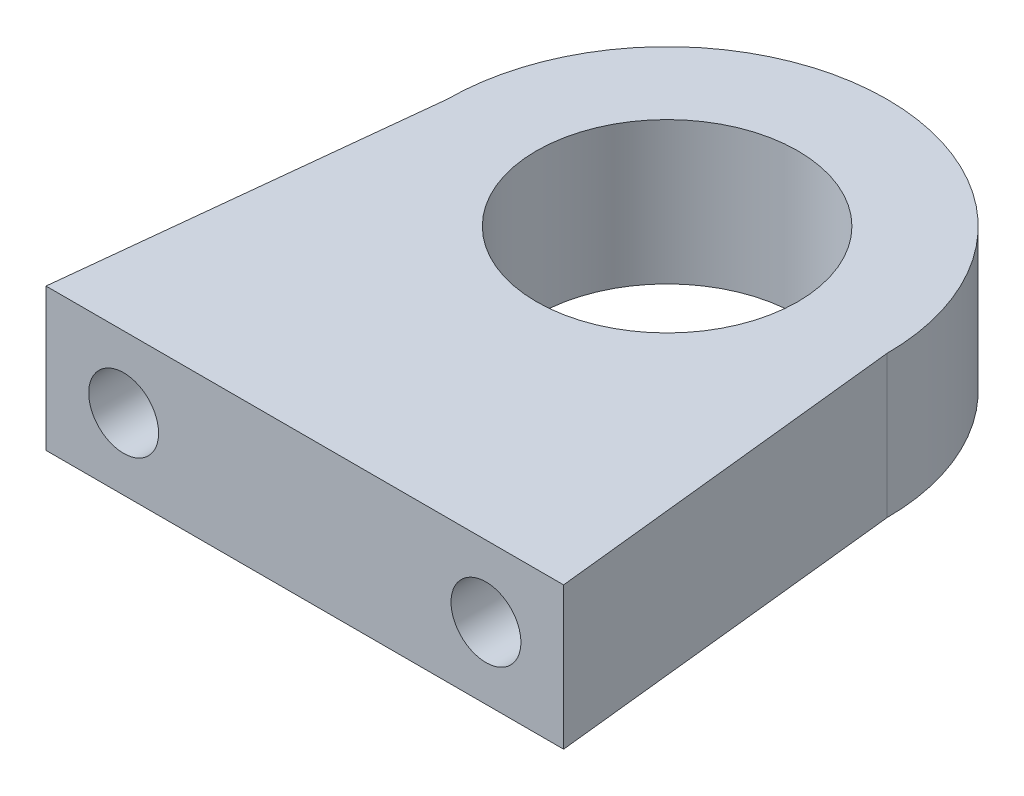
from build123d import *

# Parameters (mm, degrees)
SKETCH1_R           = 5.05
BOSS_EXTRUDE1_DEPTH = 5.5
SKETCH2_R           = 1.35
CUT_EXTRUDE1_DEPTH  = 10


with BuildPart() as part:
    # Sketch1 → Boss-Extrude1 (new body)
    with BuildSketch(Plane(origin=(0, 0, 0), x_dir=(1, 0, 0), z_dir=(0, 1, 0))):
        with BuildLine():
            Line((-10, 0), (-8.5, 14))
            ThreePointArc((-8.5, 14), (0, 22.5), (8.5, 14))
            Line((8.5, 14), (10, 0))
            Line((10, 0), (-10, 0))
        make_face()
        with Locations(Location((0, 14, 0), (0, 0, 270))):
            Circle(SKETCH1_R, mode=Mode.SUBTRACT)
    extrude(amount=BOSS_EXTRUDE1_DEPTH)

    # Sketch2 → Cut-Extrude1 (cut)
    with BuildSketch(Plane.XY):
        with Locations((-7, 2.75)):
            Circle(SKETCH2_R)
        with Locations(Location((7, 2.75, 0), (0, 0, 180))):
            Circle(SKETCH2_R)
    extrude(amount=-CUT_EXTRUDE1_DEPTH, mode=Mode.SUBTRACT)


solid = part.part
